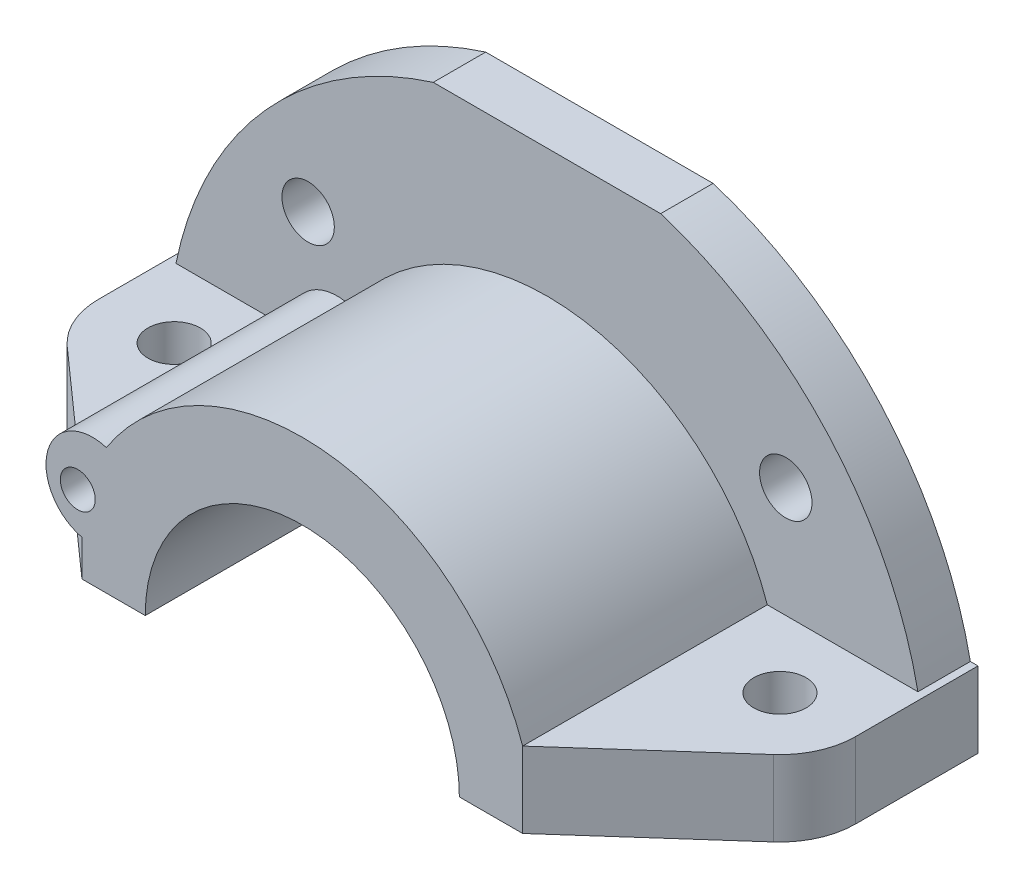
from build123d import *

# Parameters (mm, degrees)
BOSS_EXTRUDE1_DEPTH       = 51
BOSS_EXTRUDE3_DEPTH       = 51
SKETCH2_5_R               = 4.5
BOSS_EXTRUDE4_DEPTH       = 9
CUT_EXTRUDE2_REACH        = 105.296
SKETCH3_R                 = 4.5
CUT_EXTRUDE3_REACH        = 105.296
BOSS_EXTRUDE5_REACH       = 105.296
SKETCH4_R                 = 8
F_6_0MM_DOWEL_HOLE1_D     = 6
F_6_0MM_DOWEL_HOLE1_DEPTH = 13
F_6_0MM_DOWEL_HOLE1_TIP   = 1.802581857


with BuildPart() as part:
    # Sketch2 → Boss-Extrude1 (new body)
    with BuildSketch(Plane.XY):
        with BuildLine():
            ThreePointArc((40, 0), (39.453405592, 6.590052141), (37.828560639, 13))
            ThreePointArc((37.828560639, 13), (0, 40), (-37.828560639, 13))
            ThreePointArc((-37.828560639, 13), (-39.453405592, 6.590052141), (-40, 0))
            Line((-40, 0), (-26.965, 0))
            ThreePointArc((-26.965, 0), (0, 26.965), (26.965, 0))
            Line((26.965, 0), (40, 0))
        make_face()
    extrude(amount=BOSS_EXTRUDE1_DEPTH)

    # Sketch2<4> → Boss-Extrude3 (add)
    with BuildSketch(Plane.XY):
        with BuildLine():
            ThreePointArc((-40, 0), (-39.453405592, 6.590052141), (-37.828560639, 13))
            Line((-37.828560639, 13), (-63.686733312, 13))
            Line((-63.686733312, 13), (-65, 13))
            Line((-65, 13), (-65, 0))
            Line((-65, 0), (-40, 0))
        make_face()
        with BuildLine():
            Line((63.686733312, 13), (37.828560639, 13))
            ThreePointArc((37.828560639, 13), (39.453405592, 6.590052141), (40, 0))
            Line((40, 0), (65, 0))
            Line((65, 0), (65, 13))
            Line((65, 13), (63.686733312, 13))
        make_face()
    extrude(amount=BOSS_EXTRUDE3_DEPTH)

    # Sketch2<5> → Boss-Extrude4 (add)
    with BuildSketch(Plane.XY):
        with BuildLine():
            ThreePointArc((-37.828560639, 13), (0, 40), (37.828560639, 13))
            Line((37.828560639, 13), (63.686733312, 13))
            ThreePointArc((63.686733312, 13), (48.281028578, 43.519447141), (19.519221296, 62))
            Line((19.519221296, 62), (-19.519221296, 62))
            ThreePointArc((-19.519221296, 62), (-48.281028578, 43.519447141), (-63.686733312, 13))
            Line((-63.686733312, 13), (-37.828560639, 13))
        make_face()
        with Locations((-41, 32)):
            Circle(SKETCH2_5_R, mode=Mode.SUBTRACT)
        with Locations((41, 32)):
            Circle(SKETCH2_5_R, mode=Mode.SUBTRACT)
    extrude(amount=BOSS_EXTRUDE4_DEPTH)

    # Sketch3 → Cut-Extrude2 (cut, up to next)
    with BuildSketch(Plane(origin=(0, 0, 0), x_dir=(1, 0, 0), z_dir=(0, 1, 0)), mode=Mode.PRIVATE) as cut_extrude2_sk1:
        with BuildLine():
            Line((37.828560639, -51), (65, -51))
            Line((65, -51), (65, -21))
            ThreePointArc((65, -21), (63.859756378, -26.324112946), (60.639049437, -30.714258841))
            Line((60.639049437, -30.714258841), (37.828560639, -51))
        make_face()
    cut_extrude2_tool1 = extrude(cut_extrude2_sk1.sketch, amount=CUT_EXTRUDE2_REACH, mode=Mode.PRIVATE) & part.part
    # Sketch3 → Cut-Extrude2 (cut, up to next)
    with BuildSketch(Plane(origin=(0, 0, 0), x_dir=(1, 0, 0), z_dir=(0, 1, 0)), mode=Mode.PRIVATE) as cut_extrude2_sk2:
        with Locations(Location((52, -21, 0), (0, 0, 270))):
            Circle(SKETCH3_R)
    cut_extrude2_tool2 = extrude(cut_extrude2_sk2.sketch, amount=CUT_EXTRUDE2_REACH, mode=Mode.PRIVATE) & part.part
    # Sketch3 → Cut-Extrude2 (cut, up to next)
    with BuildSketch(Plane(origin=(0, 0, 0), x_dir=(1, 0, 0), z_dir=(0, 1, 0)), mode=Mode.PRIVATE) as cut_extrude2_sk3:
        with Locations(Location((-52, -21, 0), (0, 0, 270))):
            Circle(SKETCH3_R)
    cut_extrude2_tool3 = extrude(cut_extrude2_sk3.sketch, amount=CUT_EXTRUDE2_REACH, mode=Mode.PRIVATE) & part.part
    add(cut_extrude2_tool1.solids().sort_by_distance((56.054542, 0, 42.719243))[0], mode=Mode.SUBTRACT)
    add(cut_extrude2_tool2.solids().sort_by_distance((52, 0, 21))[0], mode=Mode.SUBTRACT)
    add(cut_extrude2_tool3.solids().sort_by_distance((-52, 0, 21))[0], mode=Mode.SUBTRACT)

    # Sketch3<4> → Cut-Extrude3 (cut, up to next)
    with BuildSketch(Plane(origin=(0, 0, 0), x_dir=(1, 0, 0), z_dir=(0, 1, 0)), mode=Mode.PRIVATE) as cut_extrude3_sk1:
        with BuildLine():
            Line((-65, -51), (-37.828560639, -51))
            Line((-37.828560639, -51), (-60.639049437, -30.714258841))
            ThreePointArc((-60.639049437, -30.714258841), (-63.859756378, -26.324112946), (-65, -21))
            Line((-65, -21), (-65, -51))
        make_face()
    cut_extrude3_tool1 = extrude(cut_extrude3_sk1.sketch, amount=CUT_EXTRUDE3_REACH, mode=Mode.PRIVATE) & part.part
    add(cut_extrude3_tool1.solids().sort_by_distance((-56.054542, 0, 42.719243))[0], mode=Mode.SUBTRACT)

    # Boss-Extrude5: up to this face of the body (flat: up to its plane)
    boss_extrude5_end = Plane(part.part.faces().sort_by_distance((-47.267324257, 42.605716574, 9))[0])
    # Sketch4 → Boss-Extrude5 (add, up to the picked face)
    with BuildSketch(Plane.XY.offset(51), mode=Mode.PRIVATE) as boss_extrude5_sk1:
        with Locations((-36, 14)):
            Circle(SKETCH4_R)
    boss_extrude5_tool1 = split(extrude(boss_extrude5_sk1.sketch, amount=-BOSS_EXTRUDE5_REACH, mode=Mode.PRIVATE), bisect_by=boss_extrude5_end, keep=Keep.BOTH, mode=Mode.PRIVATE)
    add(boss_extrude5_tool1.solids().sort_by(Axis((-36, 14, 51), (0, 0, -1)))[0])

    # Ø6.0mm Dowel Hole1
    with Locations(Plane(origin=(-38.545011934, 12.938196737, 51), x_dir=(1, 0, 0), z_dir=(0, 0, 1))):
        with Locations((0, 0)):
            Hole(F_6_0MM_DOWEL_HOLE1_D / 2, depth=F_6_0MM_DOWEL_HOLE1_DEPTH)
            with Locations((0, 0, -(F_6_0MM_DOWEL_HOLE1_DEPTH + F_6_0MM_DOWEL_HOLE1_TIP / 2))):  # 118° drill point
                Cone(0, F_6_0MM_DOWEL_HOLE1_D / 2, F_6_0MM_DOWEL_HOLE1_TIP, mode=Mode.SUBTRACT)


solid = part.part
